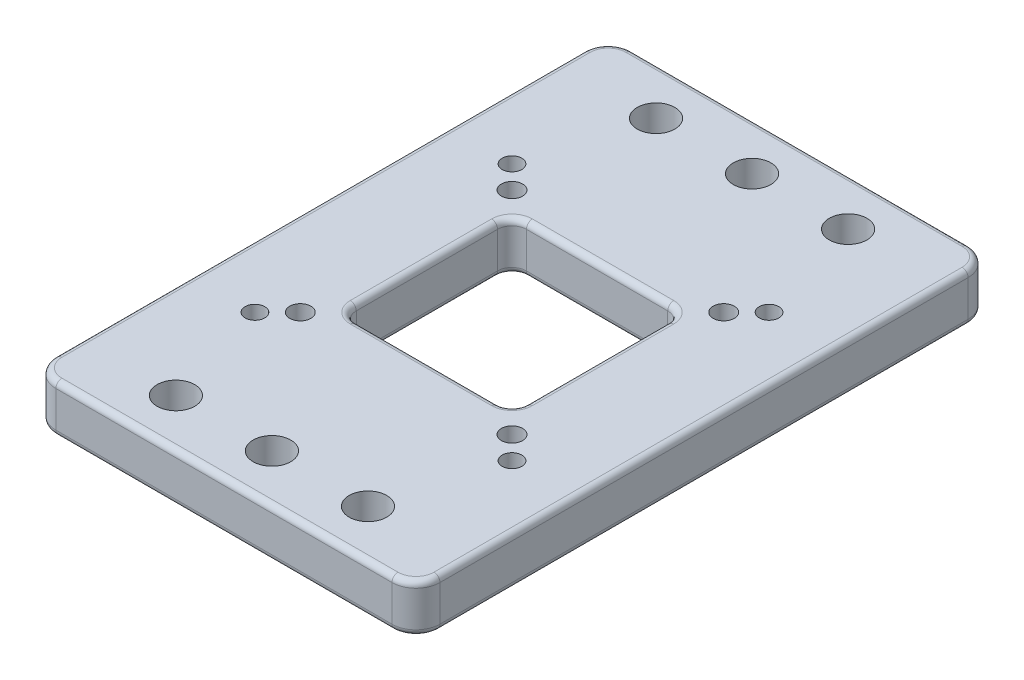
from build123d import *

# Parameters (mm, degrees)
SKETCH1_W           = 50.8
SKETCH1_H           = 76.2
SKETCH1_R           = 1.3
SKETCH1_R_2         = 1.4
SKETCH1_R_3         = 2.4892
SKETCH1_W_2         = 22.5
SKETCH1_H_2         = 22.5
BOSS_EXTRUDE1_DEPTH = 6.35
FILLET1_R           = 3.175
FILLET2_R           = 1.905
FILLET3_R           = 0.79375


with BuildPart() as part:
    # Sketch1 → Boss-Extrude1 (new body)
    with BuildSketch(Plane(origin=(0, 0, 0), x_dir=(1, 0, 0), z_dir=(0, 1, 0))):
        Rectangle(SKETCH1_W, SKETCH1_H)
        with Locations(Location((-17, 17, 0), (0, 0, 270))):
            Circle(SKETCH1_R, mode=Mode.SUBTRACT)
        with Locations(Location((-17, -17, 0), (0, 0, 270))):
            Circle(SKETCH1_R, mode=Mode.SUBTRACT)
        with Locations(Location((17, -17, 0), (0, 0, 270))):
            Circle(SKETCH1_R, mode=Mode.SUBTRACT)
        with Locations(Location((17, 17, 0), (0, 0, 270))):
            Circle(SKETCH1_R, mode=Mode.SUBTRACT)
        with Locations(Location((-14, 14, 0), (0, 0, 270))):
            Circle(SKETCH1_R_2, mode=Mode.SUBTRACT)
        with Locations(Location((14, 14, 0), (0, 0, 270))):
            Circle(SKETCH1_R_2, mode=Mode.SUBTRACT)
        with Locations(Location((14, -14, 0), (0, 0, 270))):
            Circle(SKETCH1_R_2, mode=Mode.SUBTRACT)
        with Locations(Location((-14, -14, 0), (0, 0, 270))):
            Circle(SKETCH1_R_2, mode=Mode.SUBTRACT)
        with Locations(Location((-12.7, 31.75, 0), (0, 0, 270))):
            Circle(SKETCH1_R_3, mode=Mode.SUBTRACT)
        with Locations(Location((0, 31.75, 0), (0, 0, 270))):
            Circle(SKETCH1_R_3, mode=Mode.SUBTRACT)
        with Locations(Location((12.7, 31.75, 0), (0, 0, 270))):
            Circle(SKETCH1_R_3, mode=Mode.SUBTRACT)
        with Locations(Location((12.7, -31.75, 0), (0, 0, 270))):
            Circle(SKETCH1_R_3, mode=Mode.SUBTRACT)
        with Locations(Location((0, -31.75, 0), (0, 0, 270))):
            Circle(SKETCH1_R_3, mode=Mode.SUBTRACT)
        with Locations(Location((-12.7, -31.75, 0), (0, 0, 270))):
            Circle(SKETCH1_R_3, mode=Mode.SUBTRACT)
        Rectangle(SKETCH1_W_2, SKETCH1_H_2, mode=Mode.SUBTRACT)
    extrude(amount=BOSS_EXTRUDE1_DEPTH)

    # Fillet1
    fillet1_edges = [part.edges().sort_by_distance(p)[0] for p in [
        (25.4, 3.175, 38.1),
        (-25.4, 3.175, 38.1),
        (-25.4, 3.175, -38.1),
        (25.4, 3.175, -38.1),
    ]]
    fillet(fillet1_edges, radius=FILLET1_R)

    # Fillet2
    fillet2_edges = [part.edges().sort_by_distance(p)[0] for p in [
        (-11.25, 3.175, -11.25),
        (-11.25, 3.175, 11.25),
        (11.25, 3.175, 11.25),
        (11.25, 3.175, -11.25),
    ]]
    fillet(fillet2_edges, radius=FILLET2_R)

    # Fillet3
    fillet3_edges = [part.edges().sort_by_distance(p)[0] for p in [
        (-10.692038418, 0, 10.692038418),
        (-10.692038418, 6.35, 10.692038418),
        (10.692038418, 0, -10.692038418),
        (10.692038418, 6.35, -10.692038418),
        (10.692038418, 0, 10.692038418),
        (10.692038418, 6.35, 10.692038418),
        (25.4, 0, 0),
        (25.4, 6.35, 0),
        (0, 0, 38.1),
        (-25.4, 0, 0),
        (0, 0, -38.1),
        (-24.47006403, 0, -37.17006403),
        (24.47006403, 0, -37.17006403),
        (-24.47006403, 0, 37.17006403),
        (24.47006403, 0, 37.17006403),
        (0, 6.35, 38.1),
        (0, 6.35, -38.1),
        (-25.4, 6.35, 0),
        (-24.47006403, 6.35, -37.17006403),
        (24.47006403, 6.35, -37.17006403),
        (-24.47006403, 6.35, 37.17006403),
        (24.47006403, 6.35, 37.17006403),
        (0, 0, -11.25),
        (0, 6.35, -11.25),
        (-11.25, 0, 0),
        (-11.25, 6.35, 0),
        (0, 0, 11.25),
        (0, 6.35, 11.25),
        (11.25, 0, 0),
        (11.25, 6.35, 0),
        (-10.692038418, 0, -10.692038418),
        (-10.692038418, 6.35, -10.692038418),
    ]]
    fillet(fillet3_edges, radius=FILLET3_R)


solid = part.part
